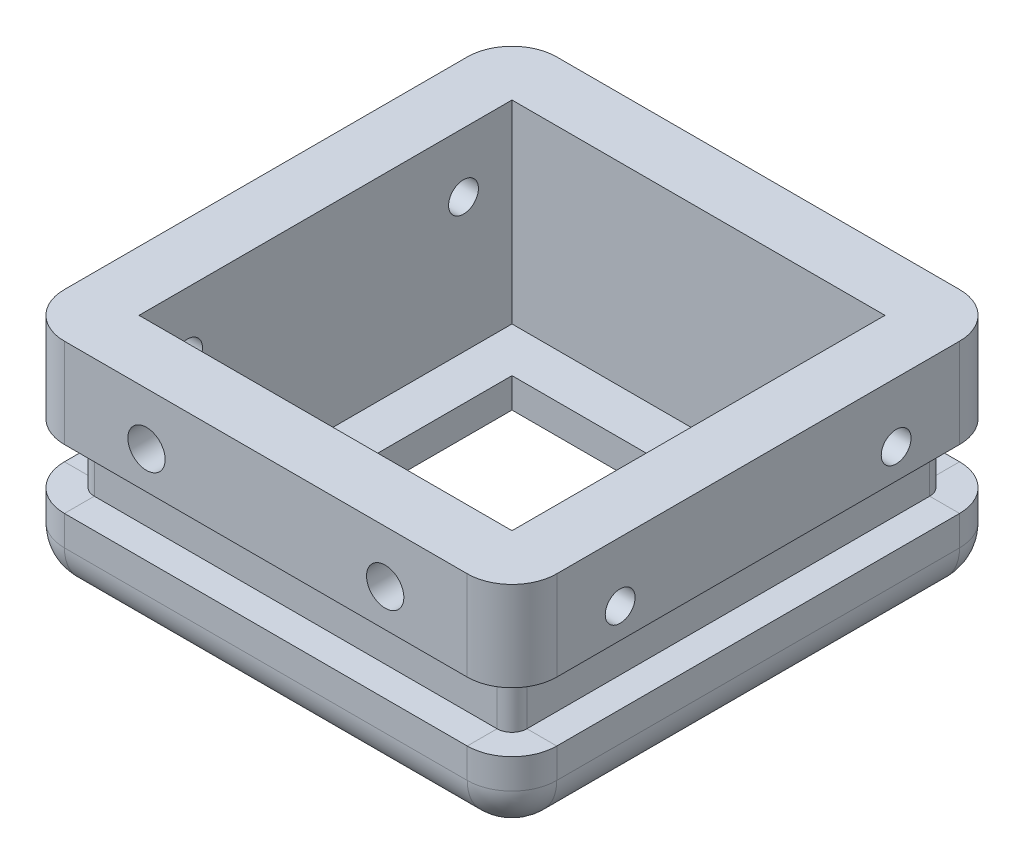
from build123d import *

# Parameters (mm, degrees)
SKETCH_1_W          = 33
SKETCH_1_H          = 33
SKETCH_1_W_2        = 13
SKETCH_1_H_2        = 13
EXTRUDE_1_DEPTH     = 15
SKETCH_2_W          = 25
SKETCH_2_H          = 25
CUT_EXTRUDE_1_DEPTH = 13
FILLET_3_R          = 3
SKETCH_4_R          = 1
CUT_EXTRUDE_2_DEPTH = 43.930175867
SKETCH_11_W         = 19
SKETCH_11_H         = 19
CUT_EXTRUDE_5_DEPTH = 2
SKETCH_14_W         = 4
SKETCH_14_H         = 2
CUT_EXTRUDE_6_DEPTH = 2
SKETCH_20_R         = 1.25
CUT_EXTRUDE_7_DEPTH = 42.412558482


with BuildPart() as part:
    # Эскиз1 → Бобышка-Вытянуть1 (new body)
    with BuildSketch(Plane(origin=(0, 0, 0), x_dir=(1, 0, 0), z_dir=(0, 1, 0))):
        with Locations((6.5, 6.5)):
            Rectangle(SKETCH_1_W, SKETCH_1_H)
        with Locations((6.5, 6.5)):
            Rectangle(SKETCH_1_W_2, SKETCH_1_H_2, mode=Mode.SUBTRACT)
    extrude(amount=EXTRUDE_1_DEPTH)

    # Эскиз2 → Вырез-Вытянуть1 (cut)
    with BuildSketch(Plane(origin=(0, 15, 0), x_dir=(1, 0, 0), z_dir=(0, 1, 0))):
        with Locations((6.5, 6.5)):
            Rectangle(SKETCH_2_W, SKETCH_2_H)
    extrude(amount=-CUT_EXTRUDE_1_DEPTH, mode=Mode.SUBTRACT)

    # Скругление3
    fillet_3_edges = [part.edges().sort_by_distance(p)[0] for p in [
        (6.5, 0, -23),
        (23, 0, -6.5),
        (6.5, 0, 10),
        (-10, 0, -6.5),
        (-10, 7.5, -23),
        (23, 7.5, -23),
        (23, 7.5, 10),
        (-10, 7.5, 10),
    ]]
    fillet(fillet_3_edges, radius=FILLET_3_R)

    # Эскиз4 → Вырез-Вытянуть2 (cut, through all)
    with BuildSketch(Plane.ZY.offset(10)):
        with Locations((2.75, 11)):
            Circle(SKETCH_4_R)
        with Locations((-15.75, 11)):
            Circle(SKETCH_4_R)
    extrude(amount=-CUT_EXTRUDE_2_DEPTH, mode=Mode.SUBTRACT)

    # Эскиз11 → Вырез-Вытянуть5 (cut)
    with BuildSketch(Plane.XZ):
        with Locations((6.5, -6.5)):
            Rectangle(SKETCH_11_W, SKETCH_11_H)
    extrude(amount=-CUT_EXTRUDE_5_DEPTH, mode=Mode.SUBTRACT)

    # Вырез-По траектории2: sweep along a path in Эскиз16
    with BuildLine(Plane(origin=(0, 7, 0), x_dir=(0, 0, 1), z_dir=(0, -1, 0))) as sweep_2_path:
        Line((-23, 7), (-23, -20))
        ThreePointArc((-23, -20), (-22.121320344, -22.121320344), (-20, -23))
        Line((-20, -23), (7, -23))
        ThreePointArc((7, -23), (9.121320344, -22.121320344), (10, -20))
        Line((10, -20), (10, 7))
        ThreePointArc((10, 7), (9.121320344, 9.121320344), (7, 10))
        Line((7, 10), (-20, 10))
        ThreePointArc((-20, 10), (-22.121320344, 9.121320344), (-23, 7))
    # Эскиз14 → Вырез-По траектории2 (sweep, cut)
    with BuildSketch(Plane(origin=(-7, 0, 0), x_dir=(0, 1, 0), z_dir=(-1, 0, 0))):
        with Locations((7, 22)):
            Rectangle(SKETCH_14_W, SKETCH_14_H)
    sweep(path=sweep_2_path.line, mode=Mode.SUBTRACT)

    # Эскиз18 → Вырез-Вытянуть6 (cut)
    with BuildSketch(Plane(origin=(0, 0, 6), x_dir=(-1, 0, 0), z_dir=(0, 0, -1))):
        Polygon((-0.5, 10.345299462), (1.5, 9.190598923), (3.5, 10.345299462), (3.5, 12.654700538), (1.5, 13.809401077), (-0.5, 12.654700538), align=None)
        Polygon((-16.5, 10.345299462), (-14.5, 9.190598923), (-12.5, 10.345299462), (-12.5, 12.654700538), (-14.5, 13.809401077), (-16.5, 12.654700538), align=None)
    extrude(amount=-CUT_EXTRUDE_6_DEPTH, mode=Mode.SUBTRACT)

    # Эскиз20 → Вырез-Вытянуть7 (cut, through all)
    with BuildSketch(Plane(origin=(0, 0, 8), x_dir=(-1, 0, 0), z_dir=(0, 0, -1))):
        with Locations((-14.5, 11.5)):
            Circle(SKETCH_20_R)
        with Locations((1.5, 11.5)):
            Circle(SKETCH_20_R)
    extrude(amount=-CUT_EXTRUDE_7_DEPTH, mode=Mode.SUBTRACT)


solid = part.part
